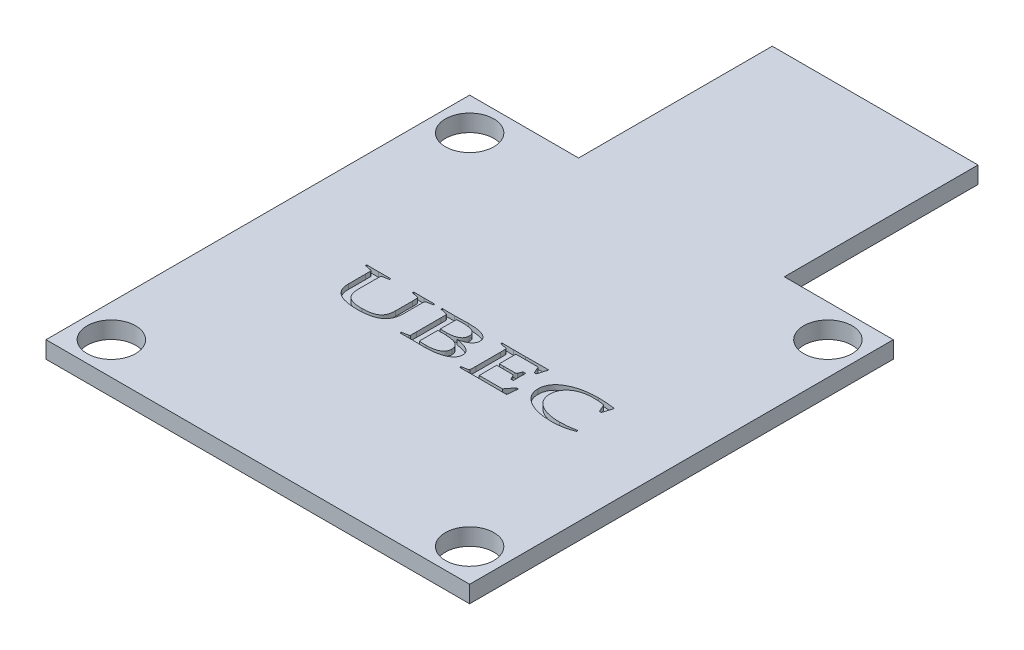
from build123d import *

# Parameters (mm, degrees)
SKETCH1_R           = 2
BOSS_EXTRUDE1_DEPTH = 1.4
CUT_EXTRUDE3_DEPTH  = 0.4


with BuildPart() as part:
    # Sketch1 → Boss-Extrude1 (new body)
    with BuildSketch(Plane(origin=(0, 0, 0), x_dir=(1, 0, 0), z_dir=(0, 1, 0))):
        Polygon((-8.5, 17.5), (-8.5, 33.5), (8.5, 33.5), (8.5, 17.5), (17.5, 17.5), (17.5, -17.5), (-17.5, -17.5), (-17.5, 17.5), align=None)
        with Locations(Location((14.8, 14.8, 0), (0, 0, 270))):
            Circle(SKETCH1_R, mode=Mode.SUBTRACT)
        with Locations(Location((14.8, -14.8, 0), (0, 0, 270))):
            Circle(SKETCH1_R, mode=Mode.SUBTRACT)
        with Locations(Location((-14.8, -14.8, 0), (0, 0, 270))):
            Circle(SKETCH1_R, mode=Mode.SUBTRACT)
        with Locations(Location((-14.8, 14.8, 0), (0, 0, 270))):
            Circle(SKETCH1_R, mode=Mode.SUBTRACT)
    extrude(amount=-BOSS_EXTRUDE1_DEPTH)

    # Sketch2 → Cut-Extrude3 (cut)
    # profile 1 of 4: a face of its own
    with BuildSketch(Plane(origin=(0, 0, 0), x_dir=(1, 0, 0), z_dir=(0, 1, 0))):
        with BuildLine():
            add(Edge.make_bspline(
                [(-9.604283479, 1.104340603), (-9.435755419, 1.101444537), (-9.105613689, 1.095771225), (-8.775424216, 1.095073075), (-8.613787175, 1.094731311)],
                knots=[0, 0, 0, 0, 1.020943702, 2, 2, 2, 2], degree=3))
            add(Edge.make_bspline(
                [(-8.613787175, 1.094731311), (-8.451164478, 1.095064828), (-8.120728371, 1.095742508), (-7.790340572, 1.101444714), (-7.622551694, 1.104340603)],
                knots=[0, 0, 0, 0, 0.984291321, 2, 2, 2, 2], degree=3))
            Line((-7.622551694, 1.104340603), (-7.606289815, 0.997160033))
            Line((-7.606289815, 0.997160033), (-8.102277143, 0.90476299))
            add(Edge.make_bspline(
                [(-8.102277143, 0.90476299), (-8.116532191, 0.902003335), (-8.142302458, 0.897014432), (-8.175339157, 0.880635346), (-8.1983676, 0.856773916), (-8.203329609, 0.836893994), (-8.205761832, 0.827149473)],
                knots=[0, 0, 0, 0, 1.248528408, 2.257088939, 3.145679163, 4, 4, 4, 4], degree=3))
            add(Edge.make_bspline(
                [(-8.205761832, 0.827149473), (-8.207034111, 0.796845417), (-8.209702254, 0.733293671), (-8.213046557, 0.633755206), (-8.213015664, 0.525316603), (-8.213592211, 0.450168625), (-8.213892771, 0.41099319)],
                knots=[0, 0, 0, 0, 0.874351634, 1.833634763, 2.870650931, 4, 4, 4, 4], degree=3))
            Line((-8.213892771, 0.41099319), (-8.213892771, -0.953526345))
            add(Edge.make_bspline(
                [(-8.213892771, -0.953526345), (-8.212794852, -1.010736036), (-8.210678969, -1.120989119), (-8.193573441, -1.279451625), (-8.166173822, -1.424676345), (-8.126343396, -1.556063824), (-8.075689592, -1.674235565), (-8.012240514, -1.77811192), (-7.937785238, -1.868694441), (-7.851305907, -1.946245288), (-7.751235847, -2.011080931), (-7.638712237, -2.066791265), (-7.512471084, -2.114425263), (-7.372434348, -2.151978182), (-7.218632684, -2.182460217), (-7.051147697, -2.203195731), (-6.869771678, -2.21578634), (-6.744432103, -2.217412737), (-6.679362676, -2.218257074)],
                knots=[0, 0, 0, 0, 1.186237032, 2.286086272, 3.301290707, 4.246926779, 5.127948014, 5.960526127, 6.76267432, 7.551577874, 8.359435147, 9.227843595, 10.151294025, 11.152981822, 12.231312082, 13.40072189, 14.650597515, 16, 16, 16, 16], degree=3))
            add(Edge.make_bspline(
                [(-6.679362676, -2.218257074), (-6.613552449, -2.21746117), (-6.486224018, -2.215921271), (-6.302366085, -2.202603507), (-6.132474188, -2.180832646), (-5.976756651, -2.150113105), (-5.834946342, -2.110513481), (-5.707028387, -2.061949752), (-5.592991691, -2.004366418), (-5.492339749, -1.937258174), (-5.404151551, -1.8594551), (-5.329239184, -1.769098213), (-5.26592143, -1.666925987), (-5.213074457, -1.553491582), (-5.17380602, -1.427292288), (-5.145025261, -1.289959271), (-5.128184519, -1.140708059), (-5.126003763, -1.037343036), (-5.12487482, -0.983832575)],
                knots=[0, 0, 0, 0, 1.375374417, 2.661049406, 3.850456785, 4.953356479, 5.975546479, 6.924305615, 7.808727595, 8.640020214, 9.446191648, 10.257887508, 11.083818906, 11.952461632, 12.866147103, 13.839821561, 14.881709292, 16, 16, 16, 16], degree=3))
            Line((-5.12487482, -0.983832575), (-5.12487482, 0.41099319))
            add(Edge.make_bspline(
                [(-5.12487482, 0.41099319), (-5.125054095, 0.450171066), (-5.125397999, 0.525326258), (-5.126963225, 0.633735269), (-5.128882261, 0.733399778), (-5.13417528, 0.796859906), (-5.136701642, 0.827149473)],
                knots=[0, 0, 0, 0, 1.128872963, 2.165524887, 3.124403605, 4, 4, 4, 4], degree=3))
            add(Edge.make_bspline(
                [(-5.136701642, 0.827149473), (-5.138582898, 0.836430281), (-5.142444371, 0.8554801), (-5.165999406, 0.878244225), (-5.199546623, 0.894559835), (-5.226192625, 0.901130174), (-5.240925506, 0.90476299)],
                knots=[0, 0, 0, 0, 0.799574859, 1.641210331, 2.695797946, 4, 4, 4, 4], degree=3))
            Line((-5.240925506, 0.90476299), (-5.708084957, 0.98976827))
            Line((-5.708084957, 0.98976827), (-5.716215897, 1.104340603))
            add(Edge.make_bspline(
                [(-5.716215897, 1.104340603), (-5.63466156, 1.102778824), (-5.477472195, 1.099768622), (-5.250787812, 1.096768723), (-5.04208866, 1.095392099), (-4.909035445, 1.094944948), (-4.845466161, 1.094731311)],
                knots=[0, 0, 0, 0, 1.124038153, 2.166492285, 3.123998827, 4, 4, 4, 4], degree=3))
            add(Edge.make_bspline(
                [(-4.845466161, 1.094731311), (-4.784360798, 1.094945911), (-4.655742614, 1.095397613), (-4.45320317, 1.096774361), (-4.231693105, 1.099779097), (-4.077706868, 1.102780048), (-3.997630892, 1.104340603)],
                knots=[0, 0, 0, 0, 0.864803013, 1.820288543, 2.866505699, 4, 4, 4, 4], degree=3))
            Line((-3.997630892, 1.104340603), (-3.982108189, 0.997160033))
            Line((-3.982108189, 0.997160033), (-4.48548728, 0.899588755))
            add(Edge.make_bspline(
                [(-4.48548728, 0.899588755), (-4.499380127, 0.896203084), (-4.524452666, 0.890092935), (-4.554817569, 0.870598103), (-4.576964229, 0.846096645), (-4.580041547, 0.82558065), (-4.581580205, 0.815322652)],
                knots=[0, 0, 0, 0, 1.235653158, 2.229993799, 3.1149969, 4, 4, 4, 4], degree=3))
            add(Edge.make_bspline(
                [(-4.581580205, 0.815322652), (-4.582562487, 0.786002122), (-4.584634244, 0.724161417), (-4.587979949, 0.626361769), (-4.589104737, 0.517436655), (-4.589501338, 0.441052809), (-4.589711145, 0.400644722)],
                knots=[0, 0, 0, 0, 0.848745362, 1.790111311, 2.830939018, 4, 4, 4, 4], degree=3))
            Line((-4.589711145, 0.400644722), (-4.589711145, -0.878869534))
            add(Edge.make_bspline(
                [(-4.589711145, -0.878869534), (-4.591111012, -0.944984671), (-4.593822465, -1.073045533), (-4.619312253, -1.258644785), (-4.661524634, -1.430676333), (-4.718343055, -1.590561011), (-4.795048319, -1.735813025), (-4.886669644, -1.868811222), (-4.997018221, -1.98699013), (-5.100927382, -2.074605686), (-5.19244199, -2.137433623), (-5.266508028, -2.181862937), (-5.345501746, -2.222737526), (-5.428689428, -2.262019068), (-5.517580955, -2.295860855), (-5.610453735, -2.328877294), (-5.708521332, -2.357554654), (-5.81124501, -2.382957495), (-5.918426511, -2.407448301), (-6.030924642, -2.425685507), (-6.147894979, -2.443072557), (-6.269652478, -2.457197517), (-6.396425421, -2.46698971), (-6.527730419, -2.475594109), (-6.664058575, -2.479781167), (-6.756481323, -2.480366577), (-6.803544303, -2.480664676)],
                knots=[0, 0, 0, 0, 1.521474162, 2.946999756, 4.302125587, 5.594130772, 6.842425176, 8.07294959, 9.301249413, 10.553352818, 11.193727559, 11.855233466, 12.540275925, 13.240715563, 13.971746935, 14.728790054, 15.509539308, 16.322609266, 17.164893597, 18.039615896, 18.945295831, 19.88742107, 20.860641119, 21.872248461, 22.91651863, 24, 24, 24, 24], degree=3))
            add(Edge.make_bspline(
                [(-6.803544303, -2.480664676), (-6.849620261, -2.480299492), (-6.94006198, -2.479582677), (-7.073679971, -2.476344407), (-7.202528463, -2.46847793), (-7.327043661, -2.45929682), (-7.446771291, -2.446416864), (-7.561961772, -2.432036097), (-7.672396134, -2.41420831), (-7.778417049, -2.393544671), (-7.879926062, -2.369877596), (-7.976993653, -2.34433864), (-8.069126761, -2.315165395), (-8.156872659, -2.283840929), (-8.239760833, -2.2487371), (-8.318443411, -2.21200266), (-8.392482644, -2.172016622), (-8.484210873, -2.115580693), (-8.588735598, -2.037101714), (-8.698904195, -1.929934703), (-8.791077713, -1.809595276), (-8.867464723, -1.677628119), (-8.925637233, -1.532842008), (-8.967829644, -1.376344465), (-8.993247088, -1.207648396), (-8.996002184, -1.091103142), (-8.997419699, -1.031139861)],
                knots=[0, 0, 0, 0, 1.108172997, 2.175214009, 3.213906675, 4.212403667, 5.177641415, 6.109619834, 7.003932497, 7.867401595, 8.706848371, 9.510346273, 10.280621484, 11.030406549, 11.750155915, 12.444654332, 13.118103992, 13.772621148, 15.033616571, 16.253005333, 17.457210181, 18.667755136, 19.909006054, 21.198432357, 22.558575485, 24, 24, 24, 24], degree=3))
            Line((-8.997419699, -1.031139861), (-8.997419699, 0.400644722))
            add(Edge.make_bspline(
                [(-8.997419699, 0.400644722), (-8.997598882, 0.441053621), (-8.997937595, 0.517439002), (-8.999447868, 0.626347362), (-9.001537957, 0.724173769), (-9.003758517, 0.786003996), (-9.004811462, 0.815322652)],
                knots=[0, 0, 0, 0, 1.169116205, 2.209993078, 3.151214545, 4, 4, 4, 4], degree=3))
            add(Edge.make_bspline(
                [(-9.004811462, 0.815322652), (-9.00639814, 0.825537028), (-9.009547515, 0.845811399), (-9.030856613, 0.871088379), (-9.061903884, 0.889822997), (-9.087071412, 0.896124967), (-9.100904387, 0.899588755)],
                knots=[0, 0, 0, 0, 0.883951059, 1.754541888, 2.765815716, 4, 4, 4, 4], degree=3))
            Line((-9.100904387, 0.899588755), (-9.596891716, 0.997160033))
            Line((-9.596891716, 0.997160033), (-9.604283479, 1.104340603))
        make_face()
    # profile 2 of 4: a face of its own
    with BuildSketch(Plane(origin=(0, 0, 0), x_dir=(1, 0, 0), z_dir=(0, 1, 0))):
        with BuildLine():
            add(Edge.make_bspline(
                [(-3.361939234, 1.104340603), (-3.192425566, 1.101444779), (-2.858095317, 1.09573337), (-2.52371714, 1.095062187), (-2.358876932, 1.094731311)],
                knots=[0, 0, 0, 0, 1.014049247, 2, 2, 2, 2], degree=3))
            add(Edge.make_bspline(
                [(-2.358876932, 1.094731311), (-2.342370258, 1.095300717), (-2.307146312, 1.096515786), (-2.25070345, 1.09678537), (-2.187132503, 1.098357691), (-2.116196908, 1.10103836), (-2.038063479, 1.101899352), (-1.952827336, 1.10452856), (-1.86067325, 1.106610404), (-1.763840147, 1.108783608), (-1.667744804, 1.110893976), (-1.577317149, 1.11305952), (-1.495279926, 1.11547448), (-1.421606353, 1.116997014), (-1.356306634, 1.117591232), (-1.299389459, 1.118256284), (-1.250854694, 1.119284357), (-1.221284919, 1.119173854), (-1.207979361, 1.11912413)],
                knots=[0, 0, 0, 0, 0.688640006, 1.469503686, 2.353274998, 3.340025207, 4.42922411, 5.611093826, 6.895667725, 8.272679489, 9.649691253, 10.903453344, 12.044243009, 13.071811742, 13.975949801, 14.767086236, 15.445223828, 16, 16, 16, 16], degree=3))
            add(Edge.make_bspline(
                [(-1.207979361, 1.11912413), (-1.138238671, 1.118649234), (-1.003121092, 1.117729157), (-0.806846048, 1.108029663), (-0.623869813, 1.092034149), (-0.453956151, 1.069836655), (-0.296989221, 1.042619672), (-0.153414204, 1.006969093), (-0.022889365, 0.96588259), (0.094675511, 0.9189727), (0.198388488, 0.86513957), (0.288714722, 0.805840084), (0.365955892, 0.741565926), (0.429115739, 0.670753077), (0.477679237, 0.593639317), (0.5131074, 0.51123595), (0.534453329, 0.422911916), (0.536775188, 0.36207819), (0.537955169, 0.331162145)],
                knots=[0, 0, 0, 0, 1.588224653, 3.077071216, 4.474198368, 5.770221334, 6.978827888, 8.100293991, 9.136713817, 10.093312824, 10.979314512, 11.793297464, 12.54987801, 13.261482446, 13.944939544, 14.616193352, 15.296741618, 16, 16, 16, 16], degree=3))
            add(Edge.make_bspline(
                [(0.537955169, 0.331162145), (0.537009963, 0.305987689), (0.53515531, 0.256591191), (0.523222729, 0.183759453), (0.502421492, 0.114311283), (0.473433487, 0.04758508), (0.435097305, -0.015138418), (0.389855762, -0.075826437), (0.335298805, -0.132558477), (0.273163248, -0.186790379), (0.20203216, -0.236786617), (0.123739443, -0.285326374), (0.036252266, -0.329014754), (-0.059046201, -0.370504569), (-0.162097417, -0.409985044), (-0.274567963, -0.444009286), (-0.394511754, -0.476784809), (-0.477834201, -0.495336625), (-0.520545359, -0.504846303)],
                knots=[0, 0, 0, 0, 0.825183678, 1.619148588, 2.411263002, 3.196014905, 3.996565454, 4.81548112, 5.672382815, 6.571152438, 7.514671756, 8.518869335, 9.587966067, 10.716306852, 11.925265978, 13.202461025, 14.56597911, 16, 16, 16, 16], degree=3))
            add(Edge.make_bspline(
                [(-0.520545359, -0.504846303), (-0.470223868, -0.510568307), (-0.372002693, -0.521736934), (-0.229408493, -0.545373654), (-0.095319982, -0.574366875), (0.030707973, -0.607202144), (0.148295597, -0.645849796), (0.258007563, -0.688216335), (0.359007719, -0.736508317), (0.451443723, -0.789289455), (0.53401658, -0.847016828), (0.607503891, -0.907116717), (0.668553307, -0.972761165), (0.718787381, -1.042234775), (0.758454218, -1.115380893), (0.785796868, -1.193002752), (0.803811837, -1.273991086), (0.805447931, -1.329669372), (0.806276183, -1.357855806)],
                knots=[0, 0, 0, 0, 1.41138245, 2.754839757, 4.026323152, 5.233949198, 6.38273821, 7.474337014, 8.509458536, 9.500069709, 10.43733111, 11.314825024, 12.140828486, 12.927950839, 13.699094265, 14.450664846, 15.215668497, 16, 16, 16, 16], degree=3))
            add(Edge.make_bspline(
                [(0.806276183, -1.357855806), (0.80473103, -1.398435885), (0.801697628, -1.478101546), (0.772912622, -1.593633957), (0.727594668, -1.702448507), (0.662888992, -1.803726852), (0.580428992, -1.897902961), (0.479119189, -1.983568567), (0.360705111, -2.063023197), (0.224498349, -2.133826918), (0.072551458, -2.197177462), (-0.093900953, -2.25206333), (-0.274051914, -2.299446455), (-0.468365247, -2.33765603), (-0.676700209, -2.366588358), (-0.898876395, -2.388051955), (-1.134905099, -2.400461792), (-1.296912292, -2.402171911), (-1.380207449, -2.40305116)],
                knots=[0, 0, 0, 0, 0.729308432, 1.431757667, 2.129444288, 2.843103195, 3.584926889, 4.374345447, 5.22434433, 6.146865296, 7.132835193, 8.184722354, 9.299215431, 10.483889255, 11.747119657, 13.083865506, 14.500684582, 16, 16, 16, 16], degree=3))
            add(Edge.make_bspline(
                [(-1.380207449, -2.40305116), (-1.450925553, -2.402533834), (-1.598044362, -2.401457611), (-1.786016781, -2.396400651), (-1.946416585, -2.392773029), (-2.07624505, -2.389051126), (-2.213261653, -2.389170602), (-2.307135441, -2.388573326), (-2.35518105, -2.388267633)],
                knots=[0, 0, 0, 0, 1.305413967, 2.715725376, 3.470951089, 4.267099625, 5.113083049, 6, 6, 6, 6], degree=3))
            add(Edge.make_bspline(
                [(-2.35518105, -2.388267633), (-2.518295241, -2.388407738), (-2.848723204, -2.388691555), (-3.179119031, -2.393317186), (-3.346416531, -2.395659397)],
                knots=[0, 0, 0, 0, 0.987290479, 2, 2, 2, 2], degree=3))
            Line((-3.346416531, -2.395659397), (-3.361939234, -2.288478826))
            Line((-3.361939234, -2.288478826), (-2.870386964, -2.196081783))
            add(Edge.make_bspline(
                [(-2.870386964, -2.196081783), (-2.855414668, -2.192723143), (-2.8285812, -2.186703762), (-2.794188203, -2.170695127), (-2.76984177, -2.147689434), (-2.764874095, -2.128005357), (-2.762467217, -2.118468267)],
                knots=[0, 0, 0, 0, 1.292114338, 2.315737527, 3.183961591, 4, 4, 4, 4], degree=3))
            add(Edge.make_bspline(
                [(-2.762467217, -2.118468267), (-2.761105081, -2.083237836), (-2.758229057, -2.008852064), (-2.756432747, -1.891052362), (-2.754849428, -1.760957515), (-2.754512499, -1.6700353), (-2.754336277, -1.622480938)],
                knots=[0, 0, 0, 0, 0.852815179, 1.800639803, 2.849685191, 4, 4, 4, 4], degree=3))
            Line((-2.754336277, -1.622480938), (-2.754336277, 0.400644722))
            add(Edge.make_bspline(
                [(-2.754336277, 0.400644722), (-2.754508398, 0.441053888), (-2.75483376, 0.517439774), (-2.756432951, 0.626344772), (-2.758233741, 0.724191435), (-2.761105337, 0.786006361), (-2.762467217, 0.815322652)],
                knots=[0, 0, 0, 0, 1.169037478, 2.209844259, 3.151002345, 4, 4, 4, 4], degree=3))
            add(Edge.make_bspline(
                [(-2.762467217, 0.815322652), (-2.764053895, 0.825537028), (-2.76720327, 0.845811399), (-2.788512368, 0.871088379), (-2.819559639, 0.889822997), (-2.844727167, 0.896124967), (-2.858560142, 0.899588755)],
                knots=[0, 0, 0, 0, 0.883951059, 1.754541888, 2.765815716, 4, 4, 4, 4], degree=3))
            Line((-2.858560142, 0.899588755), (-3.353808294, 0.997160033))
            Line((-3.353808294, 0.997160033), (-3.361939234, 1.104340603))
        make_face()
        with BuildLine():
            Line((-1.979679466, -0.651942396), (-1.979679466, -2.166514729))
            add(Edge.make_bspline(
                [(-1.979679466, -2.166514729), (-1.936424235, -2.174699262), (-1.844539486, -2.192085221), (-1.700669725, -2.202338044), (-1.554690652, -2.206738657), (-1.458072088, -2.208031289), (-1.411992032, -2.208647781)],
                knots=[0, 0, 0, 0, 0.92578563, 1.966596384, 3.03021377, 4, 4, 4, 4], degree=3))
            add(Edge.make_bspline(
                [(-1.411992032, -2.208647781), (-1.358263935, -2.208170485), (-1.254164664, -2.207245715), (-1.102927948, -2.197570792), (-0.961828994, -2.181403182), (-0.830415857, -2.159578904), (-0.708813961, -2.130957632), (-0.597157814, -2.095542424), (-0.495138292, -2.054558427), (-0.403735077, -2.006122702), (-0.321983912, -1.952561725), (-0.250930864, -1.892446494), (-0.191475002, -1.825986673), (-0.141493473, -1.754463109), (-0.104061306, -1.676076495), (-0.076413917, -1.592712742), (-0.059642755, -1.503404149), (-0.057951673, -1.441949366), (-0.057081789, -1.410337327)],
                knots=[0, 0, 0, 0, 1.462534452, 2.833689983, 4.123340011, 5.327543641, 6.458291125, 7.521103566, 8.513872424, 9.447044824, 10.332594139, 11.170015149, 11.972733495, 12.754178541, 13.537176642, 14.328377791, 15.140125749, 16, 16, 16, 16], degree=3))
            add(Edge.make_bspline(
                [(-0.057081789, -1.410337327), (-0.057881054, -1.378956707), (-0.059441941, -1.317673415), (-0.077314723, -1.229018118), (-0.104465753, -1.146412252), (-0.142265485, -1.069634049), (-0.192904744, -1.000627375), (-0.253120706, -0.937005624), (-0.325224133, -0.880725525), (-0.408083797, -0.830233909), (-0.503220252, -0.785658673), (-0.611431208, -0.747476308), (-0.73309593, -0.716547752), (-0.867743098, -0.689629534), (-1.015888778, -0.66956668), (-1.177431122, -0.654976327), (-1.352265377, -0.646083219), (-1.473332802, -0.645074312), (-1.536173658, -0.644550632)],
                knots=[0, 0, 0, 0, 0.805395399, 1.572858716, 2.313739707, 3.035847292, 3.761637923, 4.50511206, 5.280424077, 6.104690321, 6.994094704, 7.975465726, 9.04902959, 10.217586649, 11.502625517, 12.888817102, 14.385119712, 16, 16, 16, 16], degree=3))
            add(Edge.make_bspline(
                [(-1.536173658, -0.644550632), (-1.611083377, -0.644655646), (-1.75895656, -0.644862946), (-1.906753581, -0.649603376), (-1.979679466, -0.651942396)],
                knots=[0, 0, 0, 0, 1.013161635, 2, 2, 2, 2], degree=3))
        make_face(mode=Mode.SUBTRACT)
        with BuildLine():
            add(Edge.make_bspline(
                [(-1.979679466, -0.452364782), (-1.896152812, -0.452919517), (-1.72811505, -0.454035524), (-1.560073973, -0.454399338), (-1.475561198, -0.454582311)],
                knots=[0, 0, 0, 0, 0.994141474, 2, 2, 2, 2], degree=3))
            add(Edge.make_bspline(
                [(-1.475561198, -0.454582311), (-1.42775138, -0.45397174), (-1.335016753, -0.452787443), (-1.200539621, -0.444923022), (-1.07524985, -0.430773326), (-0.958883015, -0.411992086), (-0.851377526, -0.387011069), (-0.752992732, -0.356158725), (-0.663704325, -0.319876507), (-0.583116756, -0.278689927), (-0.512131179, -0.231320955), (-0.449950892, -0.179435629), (-0.397221352, -0.12205412), (-0.355466609, -0.058711777), (-0.321052396, 0.008655592), (-0.297734843, 0.081787121), (-0.283290167, 0.159838267), (-0.281808308, 0.213568131), (-0.281052222, 0.240982631)],
                knots=[0, 0, 0, 0, 1.480383595, 2.871435731, 4.168896992, 5.382998409, 6.519240308, 7.583318474, 8.572208064, 9.500342949, 10.380584557, 11.2089438, 12.002859546, 12.783653648, 13.551329279, 14.337842472, 15.151920116, 16, 16, 16, 16], degree=3))
            add(Edge.make_bspline(
                [(-0.281052222, 0.240982631), (-0.28211935, 0.269862017), (-0.28418486, 0.325760371), (-0.297991532, 0.406525753), (-0.32273736, 0.480640738), (-0.357023864, 0.548684935), (-0.400980213, 0.610626121), (-0.454911883, 0.665878813), (-0.518722139, 0.714097071), (-0.591761219, 0.756390978), (-0.674284552, 0.791915747), (-0.76471554, 0.823610917), (-0.863325641, 0.851319186), (-0.970979141, 0.872051316), (-1.087155793, 0.889012686), (-1.21194418, 0.901465976), (-1.345127549, 0.908912518), (-1.436621288, 0.909589128), (-1.483692138, 0.909937224)],
                knots=[0, 0, 0, 0, 0.895116634, 1.73256958, 2.529520932, 3.308224015, 4.085915332, 4.874405848, 5.691591279, 6.557396351, 7.484015517, 8.471896846, 9.526178218, 10.655460577, 11.867253708, 13.164405443, 14.541169604, 16, 16, 16, 16], degree=3))
            add(Edge.make_bspline(
                [(-1.483692138, 0.909937224), (-1.52016035, 0.909836711), (-1.596311398, 0.909626823), (-1.715326379, 0.906315187), (-1.844258007, 0.901620075), (-1.933372023, 0.895419221), (-1.979679466, 0.892196992)],
                knots=[0, 0, 0, 0, 0.881528171, 1.840761893, 2.877967777, 4, 4, 4, 4], degree=3))
            Line((-1.979679466, 0.892196992), (-1.979679466, -0.452364782))
        make_face(mode=Mode.SUBTRACT)
    # profile 3 of 4: a face of its own
    with BuildSketch(Plane(origin=(0, 0, 0), x_dir=(1, 0, 0), z_dir=(0, 1, 0))):
        with BuildLine():
            Line((2.549254008, 1.094731311), (3.519792551, 1.094731311))
            add(Edge.make_bspline(
                [(3.519792551, 1.094731311), (3.671077365, 1.094940449), (3.977836236, 1.095364515), (4.444012659, 1.096707287), (4.922755084, 1.099663629), (5.246016514, 1.102767407), (5.409866468, 1.104340603)],
                knots=[0, 0, 0, 0, 0.960485552, 1.947568002, 2.959693742, 4, 4, 4, 4], degree=3))
            Line((5.409866468, 1.104340603), (5.434259288, 1.084382842))
            Line((5.434259288, 1.084382842), (5.202157915, 0.313421913))
            Line((5.202157915, 0.313421913), (5.042495824, 0.296420857))
            Line((5.042495824, 0.296420857), (4.794871748, 0.872239231))
            Line((4.794871748, 0.872239231), (2.948409235, 0.872239231))
            Line((2.948409235, 0.872239231), (2.948409235, -0.499672068))
            Line((2.948409235, -0.499672068), (3.312083997, -0.499672068))
            add(Edge.make_bspline(
                [(3.312083997, -0.499672068), (3.383291747, -0.499797778), (3.529897549, -0.500056596), (3.755588838, -0.497994007), (3.993361262, -0.496893288), (4.155731104, -0.495309939), (4.239011136, -0.494497834)],
                knots=[0, 0, 0, 0, 0.921830908, 1.897908012, 2.921830036, 4, 4, 4, 4], degree=3))
            add(Edge.make_bspline(
                [(4.239011136, -0.494497834), (4.254843756, -0.493305729), (4.284291004, -0.491088521), (4.324482776, -0.48027573), (4.355877815, -0.459286272), (4.368686028, -0.439816923), (4.375019583, -0.430189492)],
                knots=[0, 0, 0, 0, 1.205769501, 2.242622688, 3.130991465, 4, 4, 4, 4], degree=3))
            Line((4.375019583, -0.430189492), (4.514723913, -0.093125078))
            Line((4.514723913, -0.093125078), (4.730563406, -0.087950843))
            add(Edge.make_bspline(
                [(4.730563406, -0.087950843), (4.72877522, -0.142401656), (4.725449918, -0.243658119), (4.721744732, -0.384349734), (4.719307917, -0.502127517), (4.718912369, -0.573096073), (4.718736584, -0.604635109)],
                knots=[0, 0, 0, 0, 1.264920481, 2.352239874, 3.267721255, 4, 4, 4, 4], degree=3))
            add(Edge.make_bspline(
                [(4.718736584, -0.604635109), (4.718676533, -0.619172743), (4.718549297, -0.649974682), (4.719634283, -0.699001224), (4.720024858, -0.753710461), (4.721888929, -0.814310468), (4.723002373, -0.880851512), (4.725595922, -0.953274036), (4.727475393, -1.031398134), (4.72951229, -1.085348164), (4.730563406, -1.113188436)],
                knots=[0, 0, 0, 0, 0.685827143, 1.453111664, 2.313380178, 3.266847139, 4.313282419, 5.452986566, 6.685643965, 8, 8, 8, 8], degree=3))
            Line((4.730563406, -1.113188436), (4.514723913, -1.123536905))
            Line((4.514723913, -1.123536905), (4.371323702, -0.781298256))
            add(Edge.make_bspline(
                [(4.371323702, -0.781298256), (4.365217598, -0.771474742), (4.353137483, -0.752040226), (4.324358778, -0.730217421), (4.288109487, -0.717060929), (4.261304602, -0.715079898), (4.247142075, -0.714033209)],
                knots=[0, 0, 0, 0, 0.928064442, 1.836052084, 2.856664743, 4, 4, 4, 4], degree=3))
            add(Edge.make_bspline(
                [(4.247142075, -0.714033209), (4.162629953, -0.713246552), (3.997795916, -0.711712241), (3.756823338, -0.710261415), (3.528416842, -0.709446434), (3.380334668, -0.709548541), (3.308388116, -0.709598151)],
                knots=[0, 0, 0, 0, 1.080338526, 2.107112627, 3.080330075, 4, 4, 4, 4], degree=3))
            Line((3.308388116, -0.709598151), (2.948409235, -0.709598151))
            Line((2.948409235, -0.709598151), (2.948409235, -1.617306704))
            add(Edge.make_bspline(
                [(2.948409235, -1.617306704), (2.948831713, -1.708969299), (2.949671078, -1.891081007), (2.95426067, -2.073136722), (2.956540175, -2.163558024)],
                knots=[0, 0, 0, 0, 1.006663399, 2, 2, 2, 2], degree=3))
            Line((2.956540175, -2.163558024), (4.874702793, -2.163558024))
            Line((4.874702793, -2.163558024), (5.362559182, -1.530083895))
            Line((5.362559182, -1.530083895), (5.542179034, -1.510126134))
            Line((5.542179034, -1.510126134), (5.454217049, -2.377919164))
            Line((5.454217049, -2.377919164), (5.426128348, -2.395659397))
            add(Edge.make_bspline(
                [(5.426128348, -2.395659397), (5.257103078, -2.394740958), (4.925458522, -2.392938888), (4.438101073, -2.389151345), (3.970443157, -2.389166424), (3.665410108, -2.388563006), (3.516096669, -2.388267633)],
                knots=[0, 0, 0, 0, 1.061927119, 2.083607666, 3.061927448, 4, 4, 4, 4], degree=3))
            Line((3.516096669, -2.388267633), (2.564776711, -2.388267633))
            add(Edge.make_bspline(
                [(2.564776711, -2.388267633), (2.40166252, -2.388407738), (2.071234558, -2.388691555), (1.740838731, -2.393317186), (1.573541231, -2.395659397)],
                knots=[0, 0, 0, 0, 0.987290479, 2, 2, 2, 2], degree=3))
            Line((1.573541231, -2.395659397), (1.558018527, -2.288478826))
            Line((1.558018527, -2.288478826), (2.049570798, -2.196081783))
            add(Edge.make_bspline(
                [(2.049570798, -2.196081783), (2.064543094, -2.192723143), (2.091376561, -2.186703762), (2.125769558, -2.170695127), (2.150115991, -2.147689434), (2.155083667, -2.128005357), (2.157490544, -2.118468267)],
                knots=[0, 0, 0, 0, 1.292114338, 2.315737527, 3.183961591, 4, 4, 4, 4], degree=3))
            add(Edge.make_bspline(
                [(2.157490544, -2.118468267), (2.15885268, -2.083237836), (2.161728704, -2.008852064), (2.163525014, -1.891052362), (2.165108333, -1.760957515), (2.165445263, -1.6700353), (2.165621484, -1.622480938)],
                knots=[0, 0, 0, 0, 0.852815179, 1.800639803, 2.849685191, 4, 4, 4, 4], degree=3))
            Line((2.165621484, -1.622480938), (2.165621484, 0.400644722))
            add(Edge.make_bspline(
                [(2.165621484, 0.400644722), (2.165449363, 0.441053888), (2.165124001, 0.517439774), (2.16352481, 0.626344772), (2.161724021, 0.724191435), (2.158852425, 0.786006361), (2.157490544, 0.815322652)],
                knots=[0, 0, 0, 0, 1.169037478, 2.209844259, 3.151002345, 4, 4, 4, 4], degree=3))
            add(Edge.make_bspline(
                [(2.157490544, 0.815322652), (2.155903866, 0.825537028), (2.152754491, 0.845811399), (2.131445394, 0.871088379), (2.100398122, 0.889822997), (2.075230595, 0.896124967), (2.061397619, 0.899588755)],
                knots=[0, 0, 0, 0, 0.883951059, 1.754541888, 2.765815716, 4, 4, 4, 4], degree=3))
            Line((2.061397619, 0.899588755), (1.566149467, 0.997160033))
            Line((1.566149467, 0.997160033), (1.558018527, 1.104340603))
            add(Edge.make_bspline(
                [(1.558018527, 1.104340603), (1.726546589, 1.10144456), (2.056934679, 1.095767059), (2.387370564, 1.095071884), (2.549254008, 1.094731311)],
                knots=[0, 0, 0, 0, 1.020182426, 2, 2, 2, 2], degree=3))
        make_face()
    # profile 4 of 4: a face of its own
    with BuildSketch(Plane(origin=(0, 0, 0), x_dir=(1, 0, 0), z_dir=(0, 1, 0))):
        with BuildLine():
            Line((10.652105117, 0.233590867), (10.491703849, 0.21880734))
            Line((10.491703849, 0.21880734), (10.200468369, 0.875195936))
            add(Edge.make_bspline(
                [(10.200468369, 0.875195936), (10.119737311, 0.887217324), (9.962558583, 0.910622275), (9.73164603, 0.933382683), (9.512531169, 0.949726572), (9.370155198, 0.951303242), (9.300890755, 0.952070276)],
                knots=[0, 0, 0, 0, 1.083637515, 2.109779929, 3.08042741, 4, 4, 4, 4], degree=3))
            add(Edge.make_bspline(
                [(9.300890755, 0.952070276), (9.221508909, 0.950855841), (9.066671604, 0.948487039), (8.84121459, 0.928302071), (8.628728298, 0.895409876), (8.429272465, 0.848871455), (8.2423577, 0.78974354), (8.06929334, 0.715047955), (7.908676951, 0.628818102), (7.762267247, 0.529166619), (7.631811559, 0.418315342), (7.516679825, 0.299932826), (7.419887667, 0.172470358), (7.339954559, 0.037239857), (7.278311205, -0.106405456), (7.23453262, -0.257819249), (7.208145006, -0.417192497), (7.204808512, -0.526181468), (7.203108284, -0.581720643)],
                knots=[0, 0, 0, 0, 1.30768463, 2.550688488, 3.726002714, 4.847569669, 5.922123402, 6.951432731, 7.948669355, 8.921513347, 9.863371995, 10.764883961, 11.636893178, 12.493957678, 13.346829761, 14.205018381, 15.085303792, 16, 16, 16, 16], degree=3))
            add(Edge.make_bspline(
                [(7.203108284, -0.581720643), (7.203349409, -0.611808367), (7.203824692, -0.671114673), (7.213162531, -0.758807832), (7.223816187, -0.844478903), (7.242395596, -0.927435711), (7.263966453, -1.00849089), (7.292555854, -1.086722794), (7.325097944, -1.162973006), (7.361851213, -1.237481895), (7.405195005, -1.308823909), (7.452157627, -1.378671009), (7.505358463, -1.445360256), (7.562614349, -1.510233089), (7.625138947, -1.57261368), (7.692547416, -1.632537636), (7.765138915, -1.690220647), (7.86948074, -1.764621822), (8.010559038, -1.850391081), (8.194473346, -1.93834193), (8.393276551, -2.013125978), (8.607824667, -2.073242167), (8.837575352, -2.120372598), (9.08253771, -2.153728329), (9.34264654, -2.175014615), (9.521121892, -2.177212348), (9.612823174, -2.178341551)],
                knots=[0, 0, 0, 0, 0.669137453, 1.318945546, 1.961004115, 2.589049692, 3.208928318, 3.826352836, 4.440481795, 5.053508298, 5.673192893, 6.296722518, 6.925270522, 7.570039197, 8.221395362, 8.889386126, 9.576150937, 10.283658951, 11.740269778, 13.243572761, 14.813926033, 16.461086153, 18.196685333, 20.029025549, 21.959698968, 24, 24, 24, 24], degree=3))
            add(Edge.make_bspline(
                [(9.612823174, -2.178341551), (9.720309658, -2.176387506), (9.938342793, -2.172423785), (10.269213682, -2.142911461), (10.608600685, -2.096298091), (10.835885846, -2.050235496), (10.951471537, -2.0268104)],
                knots=[0, 0, 0, 0, 0.955624574, 1.938456007, 2.951603415, 4, 4, 4, 4], degree=3))
            Line((10.951471537, -2.0268104), (10.995822118, -2.138426028))
            add(Edge.make_bspline(
                [(10.995822118, -2.138426028), (10.929361903, -2.165861675), (10.795902868, -2.220955312), (10.588483849, -2.289135167), (10.375153593, -2.347709056), (10.154944816, -2.394806191), (9.928719737, -2.431732423), (9.695859688, -2.458140165), (9.456614928, -2.475005349), (9.294759397, -2.476800422), (9.21292877, -2.477707971)],
                knots=[0, 0, 0, 0, 0.944035574, 1.895721771, 2.865242462, 3.848400729, 4.851753942, 5.874519692, 6.925403512, 8, 8, 8, 8], degree=3))
            add(Edge.make_bspline(
                [(9.21292877, -2.477707971), (9.107910564, -2.476533627), (8.90276752, -2.474239657), (8.603080612, -2.449245816), (8.318664388, -2.413135754), (8.050222427, -2.35841221), (7.796702173, -2.290918145), (7.559532051, -2.204830789), (7.336562703, -2.106843168), (7.164005319, -2.009544366), (7.035166903, -1.925687073), (6.945551259, -1.860318766), (6.861605986, -1.793362091), (6.784756395, -1.722799467), (6.713651793, -1.650301882), (6.64811555, -1.57574087), (6.589864768, -1.497792733), (6.537143587, -1.417890342), (6.490534036, -1.335632005), (6.449446978, -1.251175472), (6.415511583, -1.163860811), (6.388256261, -1.074079425), (6.366623837, -0.98199582), (6.351368336, -0.887394699), (6.341206233, -0.790389906), (6.340238552, -0.724900429), (6.339750312, -0.691857918)],
                knots=[0, 0, 0, 0, 2.011702589, 3.929669018, 5.758454151, 7.501861008, 9.175076383, 10.780391981, 12.331556795, 13.836513991, 14.569791245, 15.276130108, 15.96108284, 16.626074703, 17.273730657, 17.906151659, 18.526492566, 19.136672319, 19.739225099, 20.336782133, 20.934693396, 21.532045254, 22.133246415, 22.745613853, 23.367103407, 24, 24, 24, 24], degree=3))
            add(Edge.make_bspline(
                [(6.339750312, -0.691857918), (6.340576202, -0.656604951), (6.34220789, -0.586956594), (6.351688526, -0.483896963), (6.368661653, -0.383539322), (6.393478365, -0.286206649), (6.423262999, -0.190972465), (6.46165305, -0.099519021), (6.504749741, -0.00986392), (6.5573949, 0.075488308), (6.614756196, 0.159364109), (6.67936082, 0.240258118), (6.751263327, 0.317792597), (6.83003946, 0.392519507), (6.914987693, 0.465052772), (7.006907786, 0.534480283), (7.105468137, 0.601318658), (7.211025234, 0.664162517), (7.321427802, 0.724943559), (7.437096104, 0.780938503), (7.556740079, 0.833315317), (7.6804824, 0.882209391), (7.808127885, 0.927322207), (7.940152873, 0.967879528), (8.076231554, 1.004882206), (8.216553815, 1.037908456), (8.361133366, 1.067904073), (8.509924004, 1.092476124), (8.66295324, 1.114123031), (8.819943944, 1.131905185), (8.981431694, 1.144982185), (9.146805506, 1.154530915), (9.316368619, 1.160602737), (9.430734351, 1.161527912), (9.488641547, 1.161996358)],
                knots=[0, 0, 0, 0, 0.834963733, 1.649615834, 2.448738075, 3.242709118, 4.02701459, 4.809407438, 5.589708439, 6.380305666, 7.181534364, 7.995350067, 8.829497768, 9.683872245, 10.565549641, 11.473540748, 12.410635517, 13.384368483, 14.381921743, 15.394517407, 16.426647266, 17.47449325, 18.544924542, 19.632069143, 20.744708223, 21.884095036, 23.045679781, 24.240999275, 25.454932606, 26.705725458, 27.98215885, 29.29147473, 30.628583058, 32, 32, 32, 32], degree=3))
            add(Edge.make_bspline(
                [(9.488641547, 1.161996358), (9.602010264, 1.160662588), (9.830137007, 1.157978702), (10.17403869, 1.137718417), (10.522049408, 1.106853161), (10.754464724, 1.075206167), (10.871640491, 1.059250846)],
                knots=[0, 0, 0, 0, 0.980125459, 1.972262145, 2.977684674, 4, 4, 4, 4], degree=3))
            Line((10.871640491, 1.059250846), (10.899729193, 1.039293085))
            Line((10.899729193, 1.039293085), (10.652105117, 0.233590867))
        make_face()
    extrude(amount=-CUT_EXTRUDE3_DEPTH, mode=Mode.SUBTRACT)


solid = part.part
